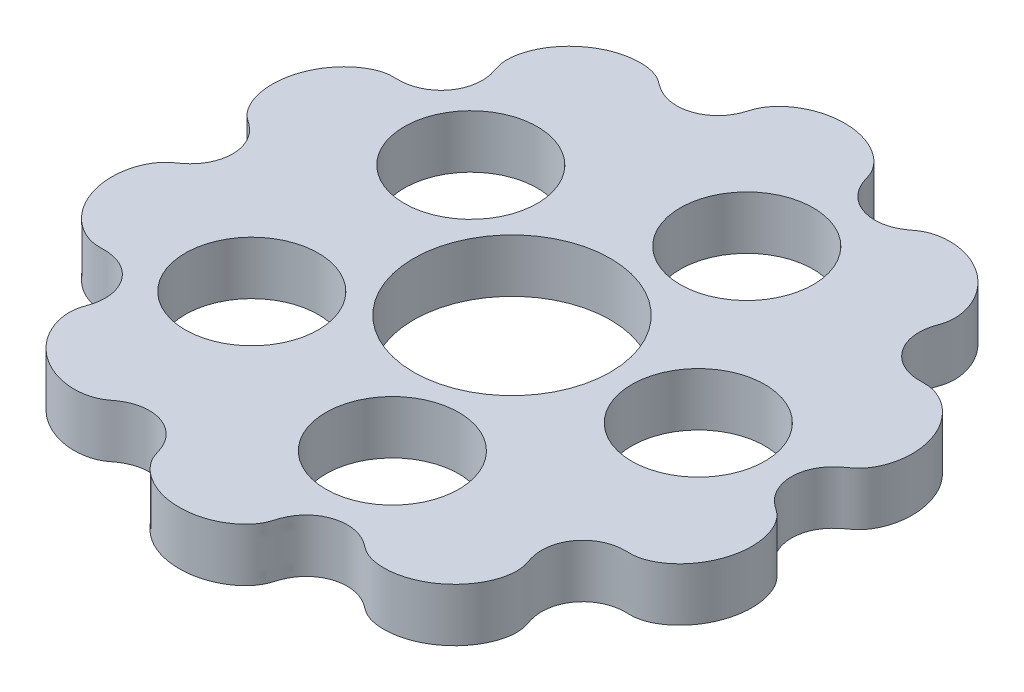
from build123d import *

# Parameters (mm, degrees)
BOSS_EXTRUDE1_DEPTH = 10
SKETCH2_R           = 18.5
CUT_EXTRUDE1_DEPTH  = 10
SKETCH3_R           = 12.5
CUT_EXTRUDE2_DEPTH  = 10


with BuildPart() as part:
    # Sketch1 → Boss-Extrude1 (new body)
    with BuildSketch(Plane(origin=(0, 0, 0), x_dir=(1, 0, 0), z_dir=(0, 1, 0))):
        with BuildLine():
            Line((52.500112047, 0.041499268), (52.5, 0))
            add(Edge.make_bspline(
                [(52.5, 0), (52.5, -0.040775104), (52.500774613, -0.123087013), (52.504260374, -0.275203234), (52.513552623, -0.474859373), (52.530965766, -0.708851543), (52.561121002, -0.98870434), (52.609439336, -1.315624541), (52.682361725, -1.681556002), (52.79478949, -2.132352063), (53.017440279, -2.830912765), (53.427825855, -3.753064751), (54.070723482, -4.744647846), (54.830098124, -5.57543267), (55.503742099, -6.156986939), (56.012379262, -6.538989783), (56.410817284, -6.8180386), (56.792354666, -7.089426209), (57.141972837, -7.372775575), (57.520705307, -7.729900694), (57.915655074, -8.169788958), (58.493265667, -8.937596576), (59.088332831, -9.999121058), (59.60031922, -11.302344039), (60.049283036, -13.196982519), (60.21435633, -15.393229318), (59.936875398, -17.972579969), (59.123851439, -20.445560196), (58.061489591, -22.416056329), (56.93724145, -23.918460352), (55.904987118, -25.008602876), (54.669536216, -26.028627864), (53.297351575, -26.859933117), (52.038099601, -27.360838699), (50.961670842, -27.590008876), (50.217402108, -27.645168686), (49.722891169, -27.643633637), (49.243636807, -27.633529208), (48.778988932, -27.638419544), (48.221278005, -27.666683373), (47.41280666, -27.758419009), (46.36184117, -27.997640241), (45.106586398, -28.507483026), (43.830924892, -29.341955818), (42.742085128, -30.41036414), (41.886481884, -31.671659022), (41.301364772, -33.057237307), (40.99581945, -34.504112382), (40.966298719, -35.851798689), (41.119084615, -36.941869369), (41.33280208, -37.775207751), (41.516924768, -38.34844275), (41.666645545, -38.77904393), (41.800656721, -39.192740913), (41.903341656, -39.593554607), (41.993133909, -40.078929424), (42.052216808, -40.649589301), (42.065252977, -41.370183161), (41.996014835, -42.235021446), (41.811794729, -43.268256263), (41.463289857, -44.44971281), (40.795122932, -46.026243031), (39.631588245, -47.891122448), (37.881243888, -49.810401445), (35.757139486, -51.328799151), (33.722804169, -52.293622479), (31.909539427, -52.841120104), (30.417481353, -53.106645377), (28.866576826, -53.18693875), (27.506439201, -53.066248838), (26.359550674, -52.806209521), (25.481229259, -52.483830009), (24.949497308, -52.22752035), (24.545269464, -51.987858636), (24.197836887, -51.752478957), (23.91719106, -51.543602368), (23.638072028, -51.333216659), (23.232003211, -51.041007331), (22.747291626, -50.720207013), (21.966309113, -50.282205151), (20.8507479, -49.837358278), (19.511516152, -49.545007241), (17.973118181, -49.515911952), (16.464788325, -49.789598147), (15.048825761, -50.353729824), (13.794685705, -51.165870404), (12.736744373, -52.179362518), (11.958645939, -53.262101177), (11.470580022, -54.23549557), (11.172776949, -55.033617241), (10.994183181, -55.601171139), (10.863038629, -56.033024877), (10.719891261, -56.439711402), (10.557601138, -56.816955145), (10.335220959, -57.252767932), (10.039175881, -57.737601345), (9.618795925, -58.314311024), (9.049448054, -58.957537258), (8.02602458, -59.914761677), (6.414925386, -61.01402137), (4.18541385, -61.99047672), (1.339206638, -62.560334562), (-1.555531464, -62.53729671), (-4.027053866, -62.002092903), (-6.020498101, -61.177979995), (-7.433612118, -60.318248685), (-8.349845643, -59.613363928), (-9.059073439, -58.943021869), (-9.588949014, -58.348313406), (-10.039829693, -57.741557787), (-10.365276791, -57.206581724), (-10.601994867, -56.725204004), (-10.784693807, -56.266063365), (-10.903590116, -55.900984278), (-11.008873941, -55.553724102), (-11.134049094, -55.16276416), (-11.269248876, -54.774995851), (-11.523977597, -54.135327447), (-11.97036594, -53.259233437), (-12.664097567, -52.265735325), (-13.688242337, -51.253082849), (-14.898427531, -50.438148562), (-16.281880822, -49.846825376), (-17.790043805, -49.530016792), (-19.353945001, -49.522503129), (-20.901974601, -49.835627594), (-22.114833491, -50.341973603), (-22.958543667, -50.848586676), (-23.503901488, -51.235222612), (-23.850472854, -51.492291991), (-24.137313704, -51.709093473), (-24.432197812, -51.915271617), (-24.84493276, -52.167528227), (-25.321855844, -52.412656958), (-25.96481748, -52.671655444), (-26.781628931, -52.905200029), (-27.808201786, -53.093827833), (-29.044525926, -53.179007384), (-30.44463053, -53.105993185), (-31.982839615, -52.825723181), (-33.849256231, -52.246902431), (-35.958134282, -51.21612146), (-37.845089492, -49.811408736), (-39.434207075, -48.089368266), (-40.517522955, -46.475169127), (-41.221930423, -45.088252289), (-41.676779129, -43.804668375), (-41.933312299, -42.66675977), (-42.045425372, -41.702444398), (-42.067377697, -40.925961222), (-42.021074543, -40.264759033), (-41.932238905, -39.723786783), (-41.810407763, -39.224890497), (-41.689047079, -38.844186817), (-41.557634437, -38.467204533), (-41.40843966, -38.011933626), (-41.263776073, -37.51715494), (-41.122558611, -36.901278864), (-41.018323259, -36.161630315), (-40.983791966, -35.380565994), (-41.035800805, -34.417307382), (-41.250683665, -33.265400151), (-41.724972968, -31.974622959), (-42.561003579, -30.626764416), (-43.666232311, -29.470591914), (-44.9678346, -28.575717503), (-46.406824522, -27.966624741), (-47.678381182, -27.698584729), (-48.721400157, -27.629657861), (-49.455398293, -27.637667477), (-49.883858288, -27.645357105), (-50.312272667, -27.637708005), (-50.984181143, -27.586491548), (-52.020178925, -27.367063728), (-53.299737285, -26.858300232), (-54.683978708, -26.018809413), (-55.929162606, -24.989246611), (-56.988984387, -23.860138009), (-58.136648947, -22.301668216), (-59.199039353, -20.273838696), (-59.986881871, -17.748693553), (-60.21964241, -15.133491801), (-60.009115811, -12.931924961), (-59.531985693, -11.105818685), (-59.020540349, -9.869815751), (-58.444529768, -8.870463614), (-57.911905451, -8.16589022), (-57.533893822, -7.745175041), (-57.186010877, -7.413925705), (-56.882639117, -7.160406886), (-56.540492932, -6.908118175), (-56.167029965, -6.648675798), (-55.670549933, -6.288310206), (-54.992871461, -5.730778683), (-54.210261673, -4.921559825), (-53.431761371, -3.793482861), (-52.830005835, -2.428848247), (-52.50018024, -0.966894579), (-52.45710778, 0.55217178), (-52.715346679, 2.061038448), (-53.262745959, 3.483189007), (-54.003522836, 4.655570316), (-54.738842919, 5.480176022), (-55.363609549, 6.038854723), (-55.822698494, 6.398885917), (-56.199652301, 6.671642922), (-56.580876946, 6.936217924), (-56.952359332, 7.21299597), (-57.356964995, 7.565455772), (-57.779033807, 8.005594079), (-58.333004427, 8.703310537), (-58.930858079, 9.690000179), (-59.468395563, 10.920525875), (-59.88098257, 12.393861768), (-60.104110317, 13.886861601), (-60.162929299, 15.77263982), (-59.894351202, 18.031901967), (-59.222128747, 20.215221461), (-58.171721151, 22.239421873), (-57.055582562, 23.777128021), (-56.02560654, 24.895455314), (-54.800789785, 25.934015099), (-53.599166224, 26.686592588), (-52.479058719, 27.188073207), (-51.541410433, 27.463768014), (-50.907996169, 27.58623828), (-50.323052413, 27.642444042), (-49.793368704, 27.645454859), (-49.161420973, 27.630897707), (-48.425638713, 27.643923436), (-47.452112168, 27.743202219), (-46.253392235, 28.031088734), (-44.966985481, 28.579010116), (-43.681931524, 29.459496211), (-42.581632308, 30.601244304), (-41.741453991, 31.940574772), (-41.260247486, 33.231303487), (-41.039889407, 34.384774707), (-40.983925413, 35.349776914), (-41.015606549, 36.13235386), (-41.117442143, 36.873430873), (-41.256894642, 37.490405082), (-41.40044371, 37.986071754), (-41.549005454, 38.442040607), (-41.680489719, 38.81941179), (-41.803238659, 39.200044109), (-41.927309345, 39.698951407), (-42.018383692, 40.240195152), (-42.066935039, 40.902074767), (-42.047115021, 41.679637388), (-41.959147144, 42.452360499), (-41.80983027, 43.215616682), (-41.552975722, 44.153132728), (-41.141175226, 45.245572709), (-40.525557083, 46.461715744), (-39.4424436, 48.079451974), (-37.85404638, 49.803595139), (-35.968278488, 51.209686131), (-33.861529251, 52.241649801), (-31.998674239, 52.821691844), (-30.46337711, 53.103608918), (-28.837187897, 53.191254625), (-27.407614237, 53.056444511), (-26.201202795, 52.76438447), (-25.279351434, 52.396703468), (-24.677788171, 52.080354109), (-24.21752736, 51.769607541), (-23.873955873, 51.509928533), (-23.528223416, 51.252981421), (-22.984627988, 50.865507158), (-22.144104002, 50.356693714), (-20.935439425, 49.846213318), (-19.3913041, 49.526456256), (-17.829254478, 49.526135593), (-16.319695021, 49.835022896), (-14.932096914, 50.419729412), (-13.715938616, 51.230198589), (-12.686115318, 52.239564641), (-11.987509156, 53.231250656), (-11.537238791, 54.106589689), (-11.280154609, 54.74590305), (-11.143490652, 55.134555258), (-11.017251726, 55.52655965), (-10.911617075, 55.874694641), (-10.793605506, 56.240873359), (-10.61264544, 56.701454513), (-10.377657722, 57.184306701), (-10.05367296, 57.721089897), (-9.603957867, 58.330025828), (-9.074733276, 58.927008479), (-8.365866072, 59.599921208), (-7.44951617, 60.307550778), (-6.035632673, 61.170720627), (-4.04018557, 61.998420975), (-1.579089164, 62.533605592), (1.291815666, 62.561795887), (3.752258944, 62.079889071), (5.745965785, 61.307921444), (7.199793361, 60.474219704), (8.183788526, 59.75526832), (9.08534121, 58.934715248), (9.77298311, 58.141310376), (10.26637145, 57.40134047), (10.590569673, 56.751733025), (10.782976111, 56.272926309), (10.929805218, 55.818826792), (11.082053727, 55.310602543), (11.272919801, 54.75795526), (11.507073298, 54.188205456), (11.795151363, 53.608443196), (12.233667119, 52.879331142), (12.884248795, 52.038068903), (13.796070035, 51.167665373), (15.032902903, 50.363317809), (16.441314941, 49.796050701), (17.946742147, 49.517551845), (19.490594486, 49.54245585), (20.988089237, 49.865761077), (22.166965774, 50.368484275), (23.002510374, 50.877366694), (23.541879966, 51.263001962), (23.883796536, 51.517387838), (24.223900371, 51.774078316), (24.677797346, 52.079837114), (25.268883718, 52.391266914), (26.172078382, 52.754113463), (27.352445592, 53.045797013), (28.752366956, 53.187326819), (30.346839996, 53.115359385), (31.854236365, 52.854985782), (33.686501376, 52.309236301), (35.734839756, 51.343386182), (37.867854874, 49.822880178), (39.622725085, 47.902057151), (40.786724772, 46.041502486), (41.456361051, 44.468438722), (41.80657843, 43.289417372), (41.99284709, 42.258198954), (42.064280359, 41.394940087), (42.053563066, 40.675459718), (41.996733194, 40.105472702), (41.909150659, 39.620367743), (41.808437593, 39.21948535), (41.675961045, 38.805916273), (41.526336774, 38.376128681), (41.341357817, 37.804547222), (41.125224382, 36.973353631), (40.968386981, 35.885816058), (40.991909962, 34.540385624), (41.290083968, 33.094121724), (41.86974643, 31.701518261), (42.727245107, 30.42570814), (43.826776707, 29.342697928), (45.124572371, 28.495874409), (46.306742469, 28.021705499), (47.276769412, 27.789943287), (48.00922742, 27.689721552), (48.479227355, 27.650650673), (48.950392436, 27.634492295), (49.421529354, 27.636348205), (49.892283913, 27.646657347), (50.363277789, 27.63803436), (50.905300024, 27.585271394), (51.51251131, 27.470335592), (52.377287443, 27.221336204), (53.447566574, 26.760818113), (54.611545034, 26.064224331), (56.112483168, 24.854029299), (57.637143252, 23.134068615), (58.989135241, 20.848764181), (59.932831288, 17.996368795), (60.213669841, 15.407261933), (60.051536889, 13.214223886), (59.606259706, 11.321795444), (59.097629324, 10.019537514), (58.506049745, 8.958102514), (57.931698947, 8.18961796), (57.539001836, 7.748957275), (57.162482014, 7.390873577), (56.814939151, 7.106469911), (56.434736206, 6.834545529), (56.036508617, 6.556332642), (55.52738295, 6.176006208), (54.85281643, 5.59762287), (54.214751532, 4.905088715), (53.646797062, 4.091977331), (53.263477344, 3.366666269), (53.046152845, 2.864253535), (52.891115189, 2.433101978), (52.782934872, 2.08053528), (52.691189954, 1.720373118), (52.616465578, 1.355469061), (52.566473841, 1.029116993), (52.534855461, 0.749611282), (52.516206484, 0.515950905), (52.505852491, 0.316761484), (52.501548502, 0.164275854), (52.500332064, 0.082243276), (52.500112047, 0.041499268)],
                knots=[0.06845127, 0.06845127, 0.06845127, 0.06845127, 0.06845127, 0.068823272, 0.069195273, 0.069567274, 0.069939276, 0.070683278, 0.071427281, 0.072154812, 0.072882343, 0.074337405, 0.07719601, 0.080073521, 0.082134054, 0.08316432, 0.084194587, 0.085079604, 0.085964622, 0.08684964, 0.087734657, 0.089174128, 0.090613599, 0.094403019, 0.097278761, 0.100154504, 0.105904344, 0.111655069, 0.117552368, 0.1205004, 0.123448432, 0.126396991, 0.129345549, 0.133079313, 0.136027875, 0.13700093, 0.137973986, 0.138947041, 0.139920097, 0.140775668, 0.141631239, 0.143342381, 0.146320718, 0.149231392, 0.152233675, 0.15526906, 0.158251886, 0.16115228, 0.164001532, 0.166843446, 0.168806033, 0.169787326, 0.17076862, 0.171582383, 0.172396147, 0.17320991, 0.174023674, 0.175465733, 0.176907793, 0.178875994, 0.180844196, 0.183714604, 0.186585013, 0.192323159, 0.198062711, 0.204015066, 0.206990805, 0.209966544, 0.212942593, 0.215918641, 0.219183194, 0.220677276, 0.222171358, 0.223272511, 0.223823088, 0.224373664, 0.225474818, 0.226025394, 0.226575971, 0.228312193, 0.230048414, 0.233063602, 0.235996078, 0.239037647, 0.242085279, 0.245051887, 0.247917801, 0.250729216, 0.253554306, 0.255492533, 0.256461646, 0.25743076, 0.258238474, 0.259046189, 0.259853904, 0.260661618, 0.26208787, 0.263514123, 0.265464894, 0.267415665, 0.273101354, 0.278785369, 0.284470299, 0.290103678, 0.295735944, 0.298553065, 0.301370187, 0.303094953, 0.304819719, 0.306226752, 0.307633785, 0.309039221, 0.30974194, 0.310444658, 0.311522042, 0.312060734, 0.312599426, 0.31367681, 0.314754194, 0.317479171, 0.320323626, 0.323166882, 0.326028942, 0.328898819, 0.332098663, 0.335219163, 0.338253411, 0.341251382, 0.342383822, 0.342950043, 0.343516263, 0.344648704, 0.345214925, 0.345781145, 0.347323091, 0.348865036, 0.350661989, 0.352458943, 0.355528451, 0.358597959, 0.361667797, 0.364737635, 0.370878007, 0.376986352, 0.380040162, 0.383093972, 0.386147981, 0.38920199, 0.390729266, 0.392256542, 0.393782993, 0.395309444, 0.39593816, 0.396566876, 0.397824309, 0.398453025, 0.399081741, 0.400339174, 0.401881099, 0.403423024, 0.404954093, 0.406485162, 0.409463946, 0.412614603, 0.415707767, 0.418884467, 0.4219674, 0.424963071, 0.427931545, 0.429055978, 0.430180411, 0.430742628, 0.431304844, 0.432429277, 0.435479881, 0.439041038, 0.442082184, 0.44512333, 0.44816352, 0.451203711, 0.45728559, 0.46305952, 0.468832192, 0.471719554, 0.474606917, 0.477880013, 0.479326404, 0.480772795, 0.481550431, 0.482328068, 0.483105704, 0.483883341, 0.484896159, 0.485908976, 0.487934612, 0.49078543, 0.493726769, 0.49663789, 0.499605508, 0.502511284, 0.505616872, 0.508611335, 0.511523531, 0.513363684, 0.51428376, 0.515203837, 0.516115167, 0.517026498, 0.517937828, 0.518849159, 0.520335083, 0.521821008, 0.524940044, 0.527904552, 0.530869061, 0.533833005, 0.53679695, 0.542726335, 0.548697614, 0.551682524, 0.554667433, 0.557653568, 0.560639704, 0.564291067, 0.565785387, 0.567279707, 0.568321479, 0.569363251, 0.570405024, 0.571446796, 0.573299705, 0.575152614, 0.578095141, 0.581116502, 0.58423972, 0.587334492, 0.590491619, 0.593476477, 0.595011269, 0.596546061, 0.598089729, 0.599633398, 0.600892048, 0.601521373, 0.602150698, 0.603409348, 0.604038673, 0.604667998, 0.606196302, 0.607724606, 0.609254007, 0.610783408, 0.612312631, 0.613841854, 0.616900299, 0.619958524, 0.623016749, 0.629133832, 0.635264708, 0.638329743, 0.641394778, 0.644459353, 0.647523928, 0.651113076, 0.652652789, 0.654192502, 0.655322957, 0.656453413, 0.657018641, 0.657583869, 0.658714324, 0.661708929, 0.664737241, 0.667851628, 0.671047845, 0.673919086, 0.676787714, 0.679636085, 0.682486592, 0.685207159, 0.686287989, 0.68736882, 0.687909236, 0.688449651, 0.689530482, 0.690233726, 0.69093697, 0.692343457, 0.693752743, 0.69516203, 0.696889481, 0.698616933, 0.701438229, 0.704259526, 0.709899918, 0.715541538, 0.721126111, 0.726710151, 0.729502368, 0.732294586, 0.734290209, 0.736285833, 0.739083712, 0.740538691, 0.741266181, 0.74199367, 0.743143851, 0.744294032, 0.745444213, 0.746594394, 0.74799041, 0.749386427, 0.752134605, 0.754942324, 0.757860682, 0.760934045, 0.764010929, 0.766913817, 0.769939, 0.772922153, 0.774040585, 0.774599801, 0.775159017, 0.776277448, 0.77739588, 0.778902389, 0.780408899, 0.783926778, 0.786931093, 0.789935409, 0.792938496, 0.795941582, 0.801949213, 0.807679923, 0.813409325, 0.816275311, 0.819141297, 0.821106721, 0.823072145, 0.824511541, 0.825950937, 0.82676387, 0.827576803, 0.828389735, 0.829202668, 0.830181625, 0.831160582, 0.833118497, 0.835958323, 0.838801693, 0.841696397, 0.844676707, 0.84776064, 0.850823682, 0.853764411, 0.85679873, 0.857726636, 0.858654542, 0.859582448, 0.860510354, 0.861436959, 0.862363564, 0.863290169, 0.864216774, 0.865719604, 0.867222434, 0.870363348, 0.873362207, 0.876361065, 0.882358431, 0.888356938, 0.894098863, 0.899840077, 0.902711294, 0.905582512, 0.909366312, 0.910804045, 0.912241777, 0.913124921, 0.914008066, 0.91489121, 0.915774354, 0.916803936, 0.917833519, 0.919892684, 0.922762104, 0.92418929, 0.925616475, 0.92634252, 0.927068565, 0.927794611, 0.928520656, 0.929264102, 0.930007548, 0.930379271, 0.930750994, 0.931122717, 0.93149444, 0.93149444, 0.93149444, 0.93149444, 0.93149444], degree=4))
        make_face()
    extrude(amount=BOSS_EXTRUDE1_DEPTH)

    # Sketch2 → Cut-Extrude1 (cut)
    with BuildSketch(Plane(origin=(0, 10, 0), x_dir=(1, 0, 0), z_dir=(0, 1, 0))):
        with Locations(Location((0, 0, 0), (0, 0, 270))):
            Circle(SKETCH2_R)
    extrude(amount=-CUT_EXTRUDE1_DEPTH, mode=Mode.SUBTRACT)

    # Sketch3 → Cut-Extrude2 (cut)
    with BuildSketch(Plane(origin=(0, 10, 0), x_dir=(1, 0, 0), z_dir=(0, 1, 0))):
        with Locations(Location((10.815594803, 33.28697807, 0), (0, 0, 270))):
            Circle(SKETCH3_R)
        with Locations(Location((35, 0, 0), (0, 0, 270))):
            Circle(SKETCH3_R)
        with Locations(Location((10.815594803, -33.28697807, 0), (0, 0, 270))):
            Circle(SKETCH3_R)
        with Locations(Location((-28.315594803, -20.57248383, 0), (0, 0, 270))):
            Circle(SKETCH3_R)
        with Locations(Location((-28.315594803, 20.57248383, 0), (0, 0, 270))):
            Circle(SKETCH3_R)
    extrude(amount=-CUT_EXTRUDE2_DEPTH, mode=Mode.SUBTRACT)


solid = part.part
